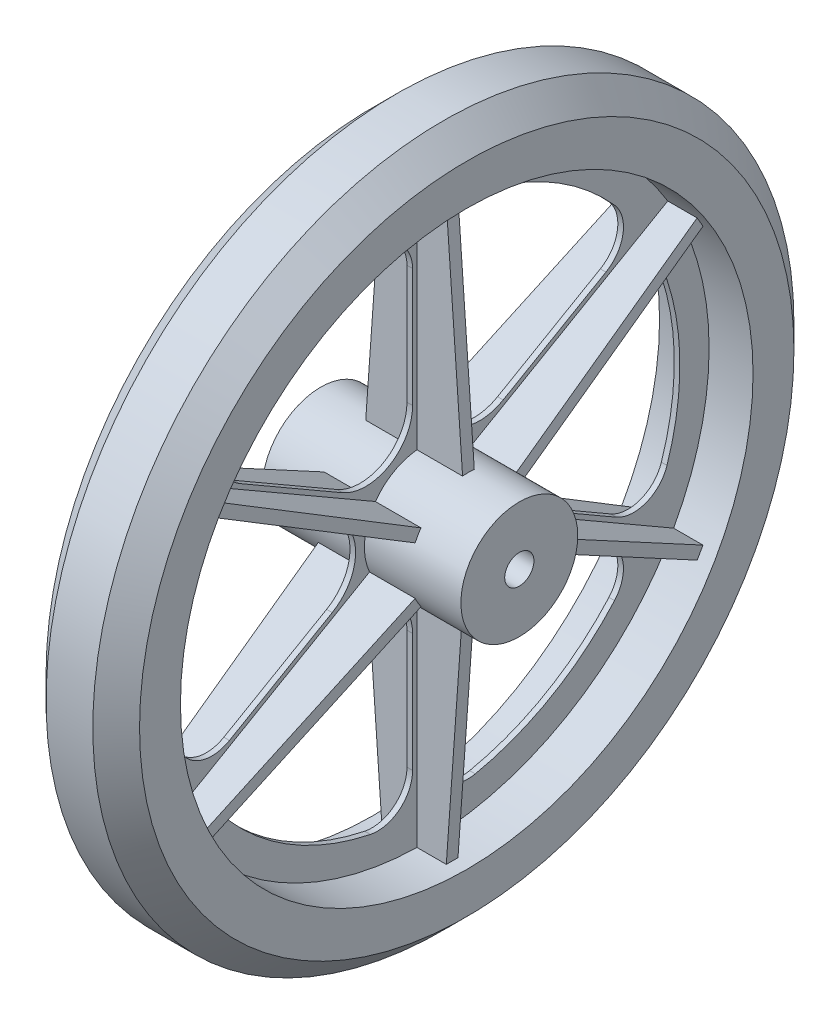
from build123d import *

# Parameters (mm, degrees)
BOSS_EXTRUDE1_DEPTH      = 26.9875
BOSS_EXTRUDE1_DEPTH_BACK = 26.9875
SKETCH1_R                = 15.875
BOSS_EXTRUDE2_DEPTH      = 0.762
BOSS_EXTRUDE2_DEPTH_BACK = 0.762
SKETCH2_R                = 95.25
BOSS_EXTRUDE3_DEPTH      = 12.7
BOSS_EXTRUDE3_DEPTH_BACK = 12.7
SKETCH3_R                = 95.25
SKETCH3_R_2              = 77.7875
CUT_EXTRUDE1_DEPTH       = 138.380676066
CIRPATTERN1_COUNT        = 6
CUT_EXTRUDE2_DEPTH       = 138.380676085
CUT_EXTRUDE2_DEPTH_BACK  = 138.380676085
SKETCH9_R                = 3.96875
CHAMFER1_SIZE            = 6.35


with BuildPart() as part:
    # Sketch1 → Boss-Extrude1 (new, two sides: drawn at the far end of the back side and taken through both)
    with BuildSketch(Plane(origin=(0, 0, 0), x_dir=(0, 0, -1), z_dir=(1, 0, 0)).offset(-BOSS_EXTRUDE1_DEPTH_BACK)):
        Circle(SKETCH1_R)
    extrude(amount=BOSS_EXTRUDE1_DEPTH + BOSS_EXTRUDE1_DEPTH_BACK)

    # Sketch2 → Boss-Extrude2 (add, two sides: drawn at the far end of the back side and taken through both)
    with BuildSketch(Plane(origin=(0, 0, 0), x_dir=(0, 0, -1), z_dir=(1, 0, 0)).offset(-BOSS_EXTRUDE2_DEPTH_BACK)):
        Circle(SKETCH2_R)
    extrude(amount=BOSS_EXTRUDE2_DEPTH + BOSS_EXTRUDE2_DEPTH_BACK)

    # Sketch3 → Boss-Extrude3 (add, two sides: drawn at the far end of the back side and taken through both)
    with BuildSketch(Plane(origin=(0, 0, 0), x_dir=(0, 0, -1), z_dir=(1, 0, 0)).offset(-BOSS_EXTRUDE3_DEPTH_BACK)):
        Circle(SKETCH3_R)
        Circle(SKETCH3_R_2, mode=Mode.SUBTRACT)
    extrude(amount=BOSS_EXTRUDE3_DEPTH + BOSS_EXTRUDE3_DEPTH_BACK)

    # Sketch4 → Cut-Extrude1 (cut, symmetric)
    with BuildSketch(Plane(origin=(0, 0, 0), x_dir=(0, 0, -1), z_dir=(1, 0, 0))):
        with BuildLine():
            Line((49.755869362, 31.934467003), (21.828125, 15.810376278))
            ThreePointArc((21.828125, 15.810376278), (9.128125, 15.810376278), (2.778125, 26.808898906))
            Line((2.778125, 26.808898906), (2.778125, 59.057080357))
            ThreePointArc((2.778125, 59.057080357), (6.293866621, 66.447238591), (14.245723684, 68.381882518))
            ThreePointArc((14.245723684, 68.381882518), (34.925, 60.491874454), (52.097585577, 46.528099865))
            ThreePointArc((52.097585577, 46.528099865), (54.398063321, 38.674267677), (49.755869362, 31.934467003))
        make_face()
    cut_extrude1 = extrude(amount=CUT_EXTRUDE1_DEPTH, both=True, mode=Mode.SUBTRACT)

    # Sketch5 → Loft1 section 0
    with BuildSketch(Plane(origin=(0, 0, 0), x_dir=(1, 0, 0), z_dir=(0, 1, 0))):
        with BuildLine():
            Line((-14.2875, -1.5875), (14.2875, -1.5875))
            Line((14.2875, -1.5875), (14.2875, 1.5875))
            Line((14.2875, 1.5875), (-14.2875, 1.5875))
            Line((-14.2875, 1.5875), (-14.2875, -1.5875))
        make_face()
    # Sketch6 → Loft1 section 1
    with BuildSketch(Plane(origin=(0, 88.9, 0), x_dir=(-1, 0, 0), z_dir=(0, 1, 0))):
        with BuildLine():
            Line((7.9375, 1.5875), (-7.9375, 1.5875))
            Line((-7.9375, 1.5875), (-7.9375, -1.5875))
            Line((-7.9375, -1.5875), (7.9375, -1.5875))
            Line((7.9375, -1.5875), (7.9375, 1.5875))
        make_face()
    loft1 = loft()

    # CirPattern1: Cut-Extrude1, Loft1 ×6 about axis
    cirpattern1_axis = Axis((0, 0, 0), (1, 0, 0))
    add([cut_extrude1.rotate(cirpattern1_axis, i * 360 / CIRPATTERN1_COUNT) for i in range(1, CIRPATTERN1_COUNT)], mode=Mode.SUBTRACT)
    add([loft1.rotate(cirpattern1_axis, i * 360 / CIRPATTERN1_COUNT) for i in range(1, CIRPATTERN1_COUNT)])

    # Sketch9 → Cut-Extrude2 (cut, two sides: drawn at the far end of the back side and taken through both)
    with BuildSketch(Plane(origin=(0, 0, 0), x_dir=(0, 0, -1), z_dir=(1, 0, 0)).offset(-CUT_EXTRUDE2_DEPTH_BACK)):
        Circle(SKETCH9_R)
    extrude(amount=CUT_EXTRUDE2_DEPTH + CUT_EXTRUDE2_DEPTH_BACK, mode=Mode.SUBTRACT)

    # Chamfer1
    chamfer1_edges = [part.edges().sort_by_distance(p)[0] for p in [
        (-12.7, 0, 95.25),
        (12.7, 0, 95.25),
    ]]
    chamfer(chamfer1_edges, length=CHAMFER1_SIZE)


solid = part.part
